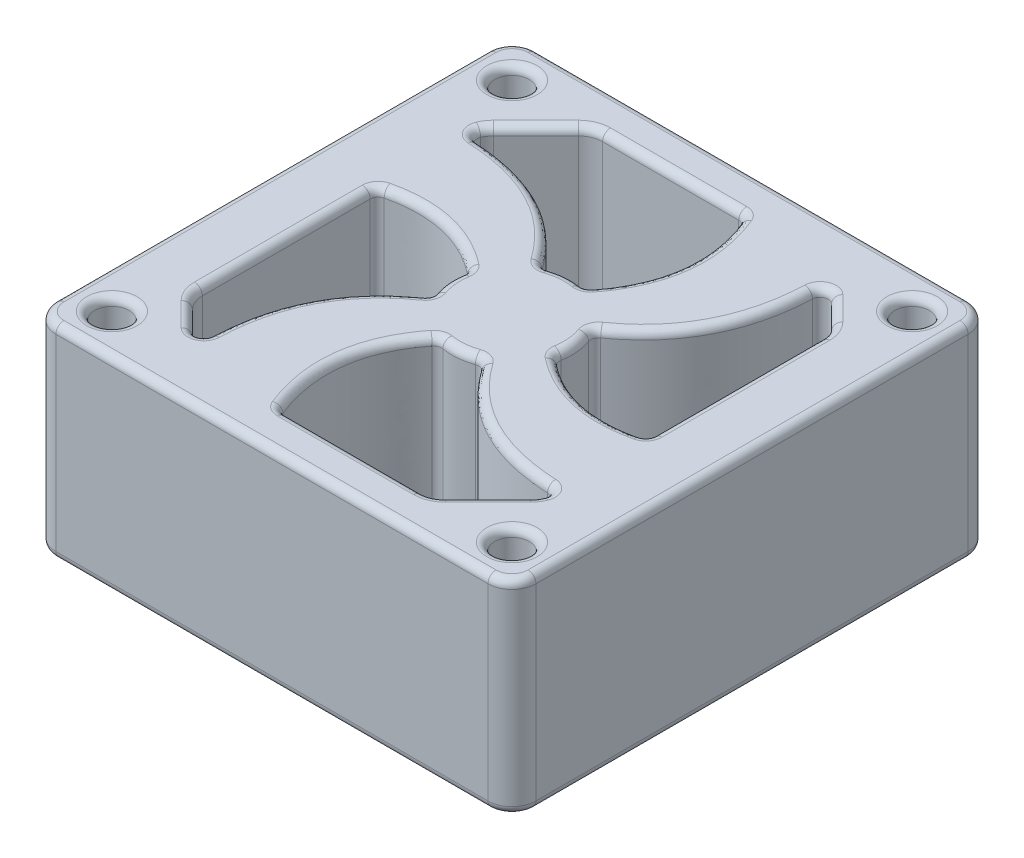
from build123d import *

# Parameters (mm, degrees)
SKETCH1_R           = 2.15
BOSS_EXTRUDE1_DEPTH = 25.5
FILLET1_R           = 1
FILLET2_R           = 1
FILLET3_R           = 1
FILLET4_R           = 1
FILLET5_R           = 1


with BuildPart() as part:
    # Sketch1 → Boss-Extrude1 (new body)
    with BuildSketch(Plane(origin=(0, 0, 0), x_dir=(1, 0, 0), z_dir=(0, 1, 0))):
        with BuildLine():
            Line((-27, 30), (27, 30))
            ThreePointArc((27, 30), (29.121320344, 29.121320344), (30, 27))
            Line((30, 27), (30, -27))
            ThreePointArc((30, -27), (29.121320344, -29.121320344), (27, -30))
            Line((27, -30), (-27, -30))
            ThreePointArc((-27, -30), (-29.121320344, -29.121320344), (-30, -27))
            Line((-30, -27), (-30, 27))
            ThreePointArc((-30, 27), (-29.121320344, 29.121320344), (-27, 30))
        make_face()
        with Locations(Location((-25, 25, 0), (0, 0, 270))):
            Circle(SKETCH1_R, mode=Mode.SUBTRACT)
        with Locations(Location((25, 25, 0), (0, 0, 270))):
            Circle(SKETCH1_R, mode=Mode.SUBTRACT)
        with Locations(Location((25, -25, 0), (0, 0, 90))):
            Circle(SKETCH1_R, mode=Mode.SUBTRACT)
        with Locations(Location((-25, -25, 0), (0, 0, 90))):
            Circle(SKETCH1_R, mode=Mode.SUBTRACT)
        with BuildLine():
            Line((16.47118155, 23.457750639), (21.121320344, 18.807611845))
            ThreePointArc((21.121320344, 18.807611845), (21.771638598, 17.834341798), (22, 16.686291501))
            Line((22, 16.686291501), (22, -5.058693268))
            add(Edge.make_bspline(
                [(7.27686486, -1.815829785), (11.647104969, -5.469370682), (16.554816682, -6.550325176), (22, -5.058693268)],
                knots=[0, 0, 0, 0, 0.847145332, 0.847145332, 0.847145332, 0.847145332], degree=3))
            ThreePointArc((7.27686486, -1.815829785), (7.463580885, 0.73821431), (6.780142348, 3.206192405))
            add(Edge.make_bspline(
                [(6.780142348, 3.206192405), (16.910116517, 9.89051041), (16.47118155, 23.457750639)],
                knots=[0, 0, 0, 1, 1, 1], degree=2))
        make_face(mode=Mode.SUBTRACT)
        with BuildLine():
            Line((-22, 16.686291501), (-22, 16.487639746))
            add(Edge.make_bspline(
                [(-3.206192405, 6.780142348), (-7.419648026, 13.16556515), (-13.684250558, 16.401397616), (-22, 16.487639746)],
                knots=[0, 0, 0, 0, 0.94552405, 0.94552405, 0.94552405, 0.94552405], degree=3))
            ThreePointArc((-3.206192405, 6.780142348), (-0.73821431, 7.463580885), (1.815829785, 7.27686486))
            add(Edge.make_bspline(
                [(1.815829785, 7.27686486), (8.284981106, 15.015041432), (4, 25)],
                knots=[0, 0, 0, 1, 1, 1], degree=2))
            Line((4, 25), (-13.686291501, 25))
            ThreePointArc((-13.686291501, 25), (-14.834341798, 24.771638598), (-15.807611845, 24.121320344))
            Line((-15.807611845, 24.121320344), (-21.121320344, 18.807611845))
            ThreePointArc((-21.121320344, 18.807611845), (-21.771638598, 17.834341798), (-22, 16.686291501))
        make_face(mode=Mode.SUBTRACT)
        with BuildLine():
            Line((15.807611845, -24.121320344), (21.121320344, -18.807611845))
            ThreePointArc((21.121320344, -18.807611845), (21.771638598, -17.834341798), (22, -16.686291501))
            Line((22, -16.686291501), (22, -16.487639746))
            add(Edge.make_bspline(
                [(3.206192405, -6.780142348), (7.419648026, -13.16556515), (13.684250558, -16.401397616), (22, -16.487639746)],
                knots=[0, 0, 0, 0, 0.94552405, 0.94552405, 0.94552405, 0.94552405], degree=3))
            ThreePointArc((3.206192405, -6.780142348), (0.73821431, -7.463580885), (-1.815829785, -7.27686486))
            add(Edge.make_bspline(
                [(-1.815829785, -7.27686486), (-8.284981106, -15.015041432), (-4, -25)],
                knots=[0, 0, 0, 1, 1, 1], degree=2))
            Line((-4, -25), (13.686291501, -25))
            ThreePointArc((13.686291501, -25), (14.834341798, -24.771638598), (15.807611845, -24.121320344))
        make_face(mode=Mode.SUBTRACT)
        with BuildLine():
            Line((-16.47118155, -23.457750639), (-21.121320344, -18.807611845))
            ThreePointArc((-21.121320344, -18.807611845), (-21.771638598, -17.834341798), (-22, -16.686291501))
            Line((-22, -16.686291501), (-22, 5.058693267))
            add(Edge.make_bspline(
                [(-7.27686486, 1.815829785), (-11.64710497, 5.469370682), (-16.554816682, 6.550325176), (-22, 5.058693267)],
                knots=[0, 0, 0, 0, 0.847145332, 0.847145332, 0.847145332, 0.847145332], degree=3))
            ThreePointArc((-7.27686486, 1.815829785), (-7.463580885, -0.73821431), (-6.780142348, -3.206192405))
            add(Edge.make_bspline(
                [(-6.780142348, -3.206192405), (-16.910116517, -9.89051041), (-16.47118155, -23.457750639)],
                knots=[0, 0, 0, 1, 1, 1], degree=2))
        make_face(mode=Mode.SUBTRACT)
    extrude(amount=BOSS_EXTRUDE1_DEPTH)

    # Fillet1
    fillet1_edges = [part.edges().sort_by_distance(p)[0] for p in [
        (-25, 25.5, 27.15),
        (-3.206192405, 12.75, -6.780142348),
    ]]
    fillet(fillet1_edges, radius=FILLET1_R)

    # Fillet2
    fillet2_edges = [part.edges().sort_by_distance(p)[0] for p in [
        (-22, 12.75, -16.487639746),
        (1.815829785, 12.75, -7.27686486),
        (4, 12.75, -25),
    ]]
    fillet(fillet2_edges, radius=FILLET2_R)

    # Fillet3
    fillet3_edges = [part.edges().sort_by_distance(p)[0] for p in [
        (-21.690473303, 25.5, -16.920313147),
        (-11.160372936, 25.5, -14.045156889),
        (-0.644544554, 25.5, -7.472252827),
        (5.61756318, 25.5, -15.757344309),
        (-5.177387994, 25.5, -25),
        (-14.834341798, 25.5, -24.771638598),
        (-18.464466094, 25.5, -21.464466094),
        (-21.492491864, 25.5, -18.355867587),
        (3.892907443, 0, -24.827550059),
        (1.783071127, 0, -7.447136266),
        (-3.139852275, 0, -7.059565691),
        (3.892907443, 25.5, -24.827550059),
        (1.783071127, 25.5, -7.447136266),
        (-3.139852275, 25.5, -7.059565691),
        (3.206192405, 12.75, 6.780142348),
        (-21.690473303, 0, -16.920313147),
        (-21.492491864, 0, -18.355867587),
        (-18.464466094, 0, -21.464466094),
        (-14.834341798, 0, -24.771638598),
        (-5.177387994, 0, -25),
        (5.61756318, 0, -15.757344309),
        (-0.644544554, 0, -7.472252827),
        (-11.160372936, 0, -14.045156889),
    ]]
    fillet(fillet3_edges, radius=FILLET3_R)

    # Fillet4
    fillet4_edges = [part.edges().sort_by_distance(p)[0] for p in [
        (22, 12.75, 16.487639746),
        (-1.815829785, 12.75, 7.27686486),
        (-4, 12.75, 25),
    ]]
    fillet(fillet4_edges, radius=FILLET4_R)

    # Fillet5
    fillet5_edges = [part.edges().sort_by_distance(p)[0] for p in [
        (30, 0, 0),
        (29.121320344, 0, 29.121320344),
        (14.215734857, 0, 5.362371353),
        (7.27686486, 12.75, 1.815829785),
        (22, 0, -5.813799117),
        (22, 12.75, 5.058693268),
        (21.771638598, 0, -17.834341798),
        (18.796250947, 0, -21.132681242),
        (14.430261481, 0, -11.958997358),
        (16.47118155, 12.75, -23.457750639),
        (7.463580885, 0, -0.73821431),
        (6.780142348, 12.75, -3.206192405),
        (14.215734857, 25.5, 5.362371353),
        (0, 0, 30),
        (22, 25.5, -5.813799117),
        (21.771638598, 25.5, -17.834341798),
        (18.796250947, 25.5, -21.132681242),
        (14.430261481, 25.5, -11.958997358),
        (7.463580885, 25.5, -0.73821431),
        (-29.121320344, 0, 29.121320344),
        (29.121320344, 25.5, 29.121320344),
        (30, 25.5, 0),
        (0.644544554, 25.5, 7.472252827),
        (0.644544554, 0, 7.472252827),
        (3.139852275, 0, 7.059565691),
        (3.139852275, 25.5, 7.059565691),
        (29.121320344, 25.5, -29.121320344),
        (-25, 0, -27.15),
        (-25, 25.5, -27.15),
        (0, 25.5, -30),
        (-5.61756318, 0, 15.757344309),
        (-5.61756318, 25.5, 15.757344309),
        (5.177387994, 0, 25),
        (5.177387994, 25.5, 25),
        (11.160372936, 25.5, 14.045156889),
        (25, 0, -27.15),
        (11.160372936, 0, 14.045156889),
        (-1.783071127, 0, 7.447136266),
        (-1.783071127, 25.5, 7.447136266),
        (-3.892907443, 0, 24.827550059),
        (-3.892907443, 25.5, 24.827550059),
        (21.690473303, 0, 16.920313147),
        (25, 25.5, -27.15),
        (21.690473303, 25.5, 16.920313147),
        (-29.121320344, 25.5, -29.121320344),
        (25, 0, 27.15),
        (25, 25.5, 27.15),
        (-30, 25.5, 0),
        (-25, 0, 27.15),
        (-14.215734857, 0, -5.362371353),
        (-7.27686486, 12.75, -1.815829785),
        (-22, 0, 5.813799117),
        (-22, 12.75, -5.058693267),
        (-21.771638598, 0, 17.834341798),
        (-18.796250947, 0, 21.132681242),
        (-14.430261481, 0, 11.958997358),
        (-16.47118155, 12.75, 23.457750639),
        (-7.463580885, 0, 0.73821431),
        (-6.780142348, 12.75, 3.206192405),
        (-14.215734857, 25.5, -5.362371353),
        (-22, 25.5, 5.813799117),
        (-21.771638598, 25.5, 17.834341798),
        (-18.796250947, 25.5, 21.132681242),
        (-14.430261481, 25.5, 11.958997358),
        (-7.463580885, 25.5, 0.73821431),
        (-29.121320344, 25.5, 29.121320344),
        (-30, 0, 0),
        (14.834341798, 0, 24.771638598),
        (18.464466094, 0, 21.464466094),
        (21.492491864, 0, 18.355867587),
        (14.834341798, 25.5, 24.771638598),
        (18.464466094, 25.5, 21.464466094),
        (0, 25.5, 30),
        (-29.121320344, 0, -29.121320344),
        (21.492491864, 25.5, 18.355867587),
        (0, 0, -30),
        (29.121320344, 0, -29.121320344),
    ]]
    fillet(fillet5_edges, radius=FILLET5_R)


solid = part.part
